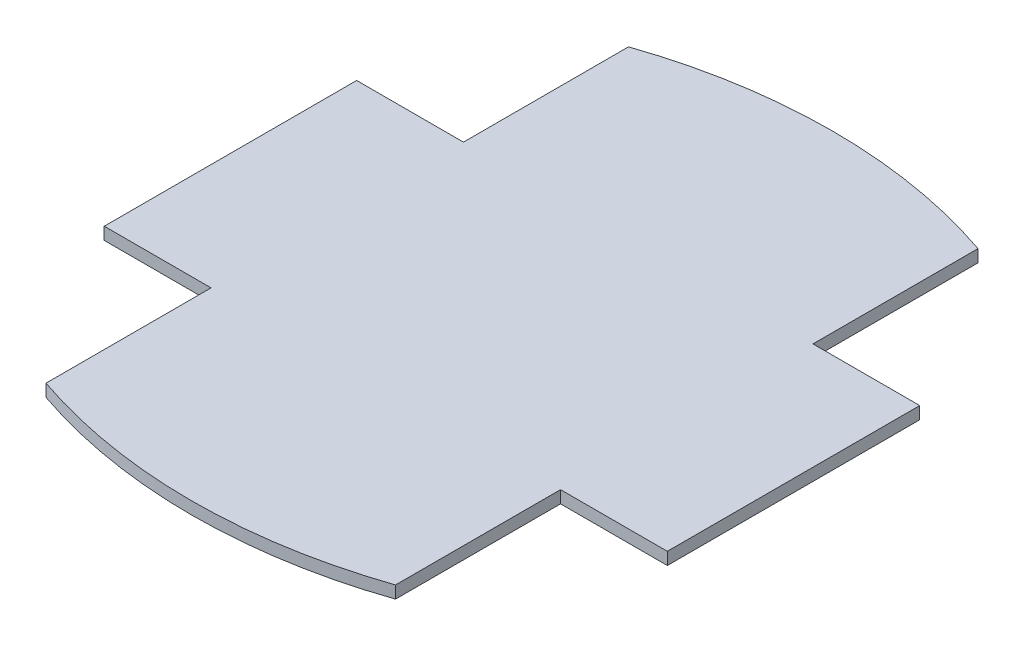
from build123d import *

# Parameters (mm, degrees)
ESQUISSE1_W        = 180
ESQUISSE1_H        = 300
ESQUISSE1_W_2      = 55
ESQUISSE1_H_2      = 130
BOSS_EXTRU_1_DEPTH = 6.35


with BuildPart() as part:
    # Esquisse1 → Boss.-Extru.1 (new body)
    with BuildSketch(Plane(origin=(0, 0, 0), x_dir=(1, 0, 0), z_dir=(0, 1, 0))):
        Rectangle(ESQUISSE1_W, ESQUISSE1_H)
        with Locations((-117.5, 0)):
            Rectangle(ESQUISSE1_W_2, ESQUISSE1_H_2)
        with Locations((117.5, 0)):
            Rectangle(ESQUISSE1_W_2, ESQUISSE1_H_2)
        with BuildLine():
            Line((-90, -150), (90, -150))
            ThreePointArc((90, -150), (0, -165), (-90, -150))
        make_face()
        with BuildLine():
            ThreePointArc((-90, 150), (0, 165), (90, 150))
            Line((90, 150), (-90, 150))
        make_face()
    extrude(amount=BOSS_EXTRU_1_DEPTH)


solid = part.part
